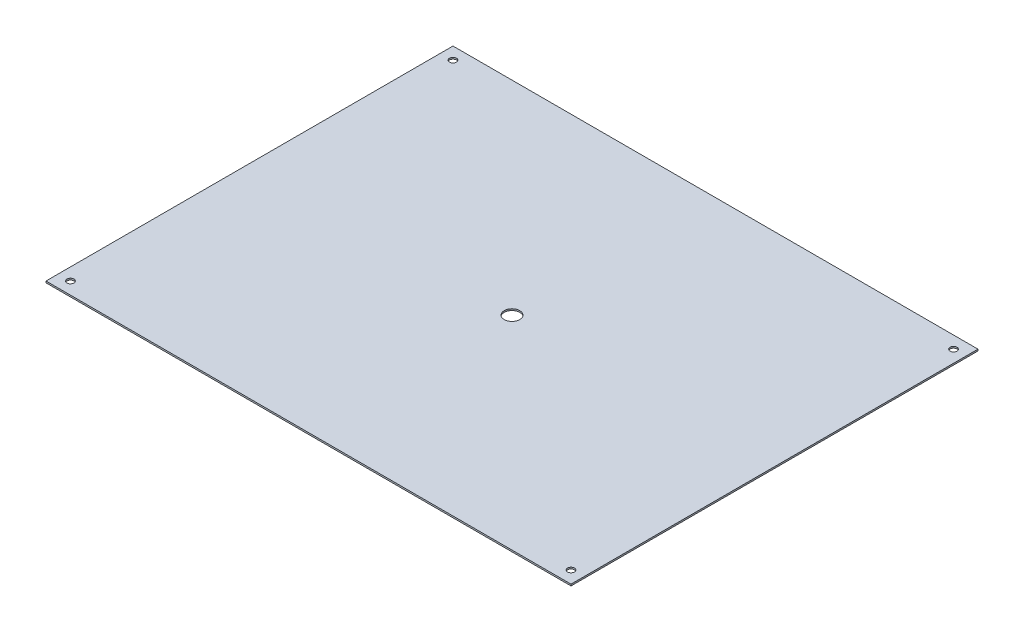
from build123d import *

# Parameters (mm, degrees)
BOSS_EXTRUDE1_DEPTH      = 152.4
BOSS_EXTRUDE1_DEPTH_BACK = 152.4
SKETCH3_W                = 304.8
SKETCH3_H                = 0.79375
SKETCH4_OUTSIDE_W        = 393.01
SKETCH4_OUTSIDE_H        = 393.01
SKETCH4_OUTSIDE_W_2      = 258
SKETCH4_OUTSIDE_H_2      = 200
FIT2ENCLOSURE_DEPTH      = 0.79375
CUBEMOUNTHOLES_D         = 3.4
DRAINHOLE_REACH          = 165.223
SKETCH8_R                = 3.81


with BuildPart() as part:
    # Sketch3 → Boss-Extrude1 (new, two sides: drawn at the far end of the back side and taken through both)
    with BuildSketch(Plane.XY.offset(-BOSS_EXTRUDE1_DEPTH_BACK)):
        Rectangle(SKETCH3_W, SKETCH3_H)
    extrude(amount=BOSS_EXTRUDE1_DEPTH + BOSS_EXTRUDE1_DEPTH_BACK)

    # Sketch4 outside → Fit2Enclosure (cut)
    with BuildSketch(Plane(origin=(0, 0.396875, 0), x_dir=(1, 0, 0), z_dir=(0, 1, 0))):
        Rectangle(SKETCH4_OUTSIDE_W, SKETCH4_OUTSIDE_H)
        Rectangle(SKETCH4_OUTSIDE_W_2, SKETCH4_OUTSIDE_H_2, mode=Mode.SUBTRACT)
    extrude(amount=-FIT2ENCLOSURE_DEPTH, mode=Mode.SUBTRACT)

    # CubeMountHoles (through all)
    with Locations(Plane(origin=(0, 0.396875, 0), x_dir=(1, 0, 0), z_dir=(0, 1, 0))):
        with Locations((-123, 94), (123, 94), (123, -94), (-122.975, -94)):
            Hole(CUBEMOUNTHOLES_D / 2)

    # Sketch8 → DrainHole (cut, up to next)
    with BuildSketch(Plane(origin=(0, 0.396875, 0), x_dir=(1, 0, 0), z_dir=(0, 1, 0)), mode=Mode.PRIVATE) as drainhole_sk1:
        with Locations(Location((0, 0, 0), (0, 0, 270))):
            Circle(SKETCH8_R)
    drainhole_tool1 = extrude(drainhole_sk1.sketch, amount=-DRAINHOLE_REACH, mode=Mode.PRIVATE) & part.part
    add(drainhole_tool1.solids().sort_by_distance((0, 0.396875, 0))[0], mode=Mode.SUBTRACT)


solid = part.part
